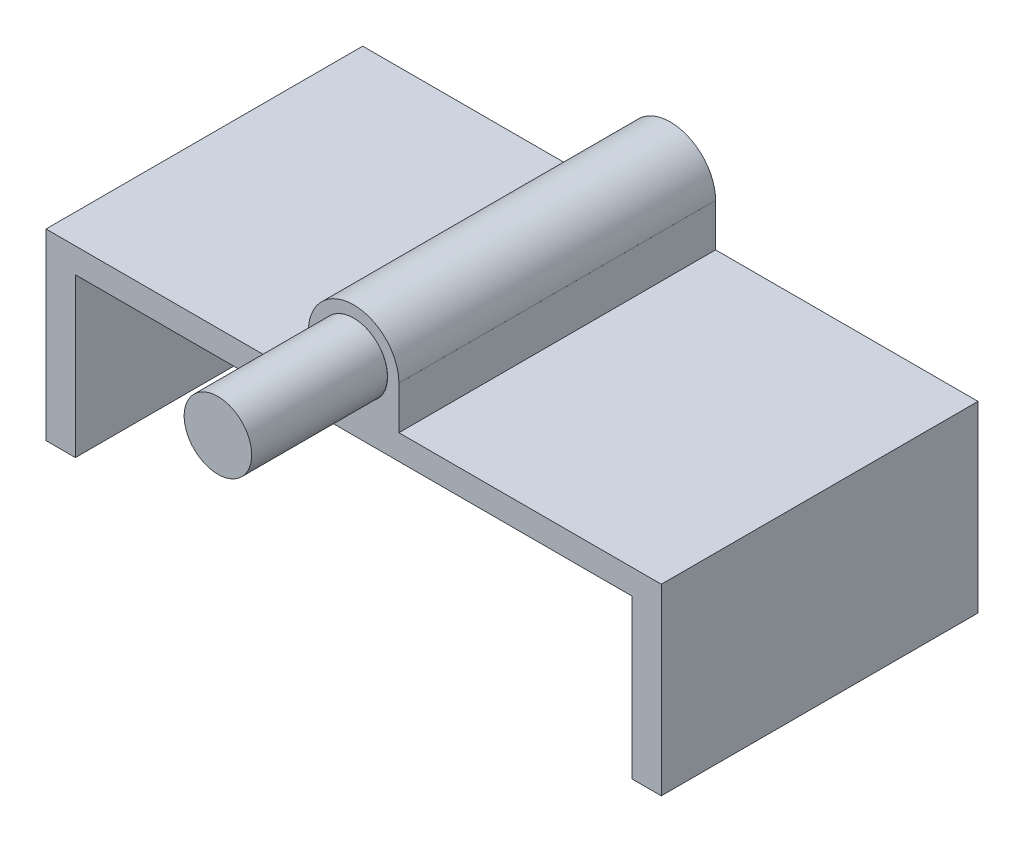
from build123d import *

# Parameters (mm, degrees)
SKETCH1_W            = 14
SKETCH1_H            = 5
BOSS_EXTRUDE1_DEPTH  = 7
SKETCH7_W            = 12
SKETCH7_H            = 3.5
CUT_EXTRUDE1_DEPTH   = 17.431676725
SKETCH8_W            = 14
SKETCH8_H            = 0.948534091
CUT_EXTRUDE2_DEPTH   = 7
SKETCH20_W           = 2
SKETCH20_H           = 0.948534091
BOSS_EXTRUDE9_DEPTH  = 7
SKETCH21_R           = 0.999676317
BOSS_EXTRUDE10_DEPTH = 7
SKETCH22_R           = 0.75
CUT_EXTRUDE3_DEPTH   = 7
SKETCH23_W           = 7
SKETCH23_H           = 4.051465909
CUT_EXTRUDE4_DEPTH   = 0.4
SKETCH24_W           = 7
SKETCH24_H           = 4.051465909
CUT_EXTRUDE5_DEPTH   = 0.4
SKETCH25_W           = 7
SKETCH25_H           = 4.051465909
BOSS_EXTRUDE13_DEPTH = 0.2
SKETCH26_W           = 7
SKETCH26_H           = 4.051465909
BOSS_EXTRUDE14_DEPTH = 0.2
SKETCH29_W           = 7
SKETCH29_H           = 3.5
CUT_EXTRUDE8_DEPTH   = 0.15
SKETCH30_W           = 7
SKETCH30_H           = 3.5
CUT_EXTRUDE9_DEPTH   = 0.15
SKETCH31_R           = 0.746179914
BOSS_EXTRUDE15_DEPTH = 3


with BuildPart() as part:
    # Sketch1 → Boss-Extrude1 (new body)
    with BuildSketch(Plane.XY):
        with Locations((7, 2.5)):
            Rectangle(SKETCH1_W, SKETCH1_H)
    extrude(amount=BOSS_EXTRUDE1_DEPTH)

    # Sketch7 → Cut-Extrude1 (cut, through all)
    with BuildSketch(Plane.XY.offset(7)):
        with Locations((7, 1.75)):
            Rectangle(SKETCH7_W, SKETCH7_H)
    extrude(amount=-CUT_EXTRUDE1_DEPTH, mode=Mode.SUBTRACT)

    # Sketch8 → Cut-Extrude2 (cut)
    with BuildSketch(Plane.XY.offset(7)):
        with Locations((7, 4.525732955)):
            Rectangle(SKETCH8_W, SKETCH8_H)
    extrude(amount=-CUT_EXTRUDE2_DEPTH, mode=Mode.SUBTRACT)

    # Sketch20 → Boss-Extrude9 (add)
    with BuildSketch(Plane.XY.offset(7)):
        with Locations((7, 4.525732955)):
            Rectangle(SKETCH20_W, SKETCH20_H)
    extrude(amount=-BOSS_EXTRUDE9_DEPTH)

    # Sketch21 → Boss-Extrude10 (add)
    with BuildSketch(Plane.XY.offset(7)):
        with Locations((7, 5)):
            Circle(SKETCH21_R)
    extrude(amount=-BOSS_EXTRUDE10_DEPTH)

    # Sketch22 → Cut-Extrude3 (cut)
    with BuildSketch(Plane.XY.offset(7)):
        with Locations((7, 4.996179914)):
            Circle(SKETCH22_R)
    extrude(amount=-CUT_EXTRUDE3_DEPTH, mode=Mode.SUBTRACT)

    # Sketch23 → Cut-Extrude4 (cut)
    with BuildSketch(Plane.ZY):
        with Locations((3.5, 2.025732955)):
            Rectangle(SKETCH23_W, SKETCH23_H)
    extrude(amount=-CUT_EXTRUDE4_DEPTH, mode=Mode.SUBTRACT)

    # Sketch24 → Cut-Extrude5 (cut)
    with BuildSketch(Plane(origin=(14, 0, 0), x_dir=(0, 0, -1), z_dir=(1, 0, 0))):
        with Locations((-3.5, 2.025732955)):
            Rectangle(SKETCH24_W, SKETCH24_H)
    extrude(amount=-CUT_EXTRUDE5_DEPTH, mode=Mode.SUBTRACT)

    # Sketch25 → Boss-Extrude13 (add)
    with BuildSketch(Plane.ZY.offset(-0.4)):
        with Locations((3.5, 2.025732955)):
            Rectangle(SKETCH25_W, SKETCH25_H)
    extrude(amount=BOSS_EXTRUDE13_DEPTH)

    # Sketch26 → Boss-Extrude14 (add)
    with BuildSketch(Plane(origin=(13.6, 0, 0), x_dir=(0, 0, -1), z_dir=(1, 0, 0))):
        with Locations((-3.5, 2.025732955)):
            Rectangle(SKETCH26_W, SKETCH26_H)
    extrude(amount=BOSS_EXTRUDE14_DEPTH)

    # Sketch29 → Cut-Extrude8 (cut)
    with BuildSketch(Plane(origin=(1, 0, 0), x_dir=(0, 0, -1), z_dir=(1, 0, 0))):
        with Locations((-3.5, 1.75)):
            Rectangle(SKETCH29_W, SKETCH29_H)
    extrude(amount=-CUT_EXTRUDE8_DEPTH, mode=Mode.SUBTRACT)

    # Sketch30 → Cut-Extrude9 (cut)
    with BuildSketch(Plane.ZY.offset(-13)):
        with Locations((3.5, 1.75)):
            Rectangle(SKETCH30_W, SKETCH30_H)
    extrude(amount=-CUT_EXTRUDE9_DEPTH, mode=Mode.SUBTRACT)


with BuildPart() as body_2:
    # Sketch31 → Boss-Extrude15 (new body)
    with BuildSketch(Plane.XY.offset(7)):
        with Locations((7, 5)):
            Circle(SKETCH31_R)
    extrude(amount=BOSS_EXTRUDE15_DEPTH)


solid = Compound([part.part, body_2.part])
